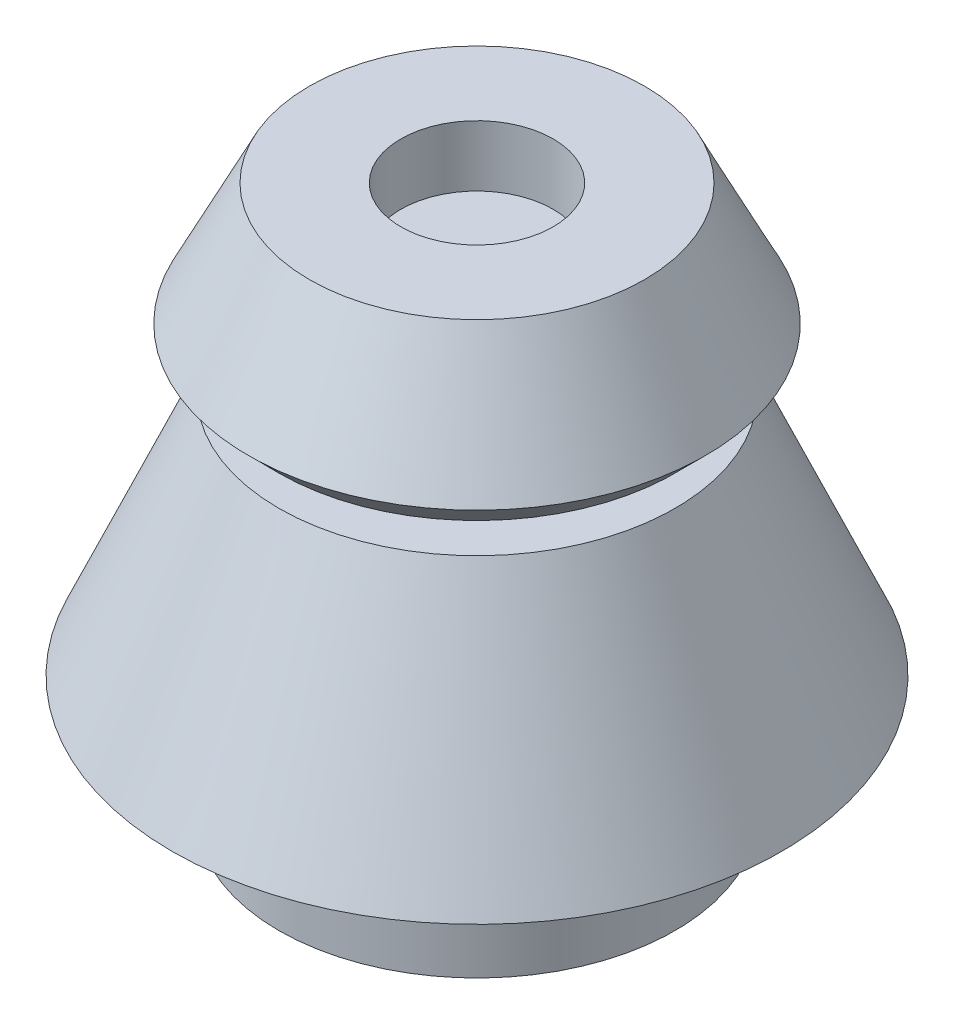
from build123d import *


with BuildPart() as part:
    # Sketch1 → Revolve1 (revolve)
    with BuildSketch(Plane.XY, mode=Mode.PRIVATE) as revolve1_sk:
        Polygon((0, 0), (-2.5, 0), (-2.5, 2), (-5.5, 2), (-7.5, -2), (-6.5, -3), (-1.5, -3), (-1.5, -4), (-6.5, -4), (-10, -12), (-6.5, -12), (-6.5, -16), (0, -16), align=None)
    revolve(revolve1_sk.sketch.rotate(Axis((0, 0, 0), (0, 1, 0)), 270), axis=Axis((0, 0, 0), (0, 1, 0)))


solid = part.part
